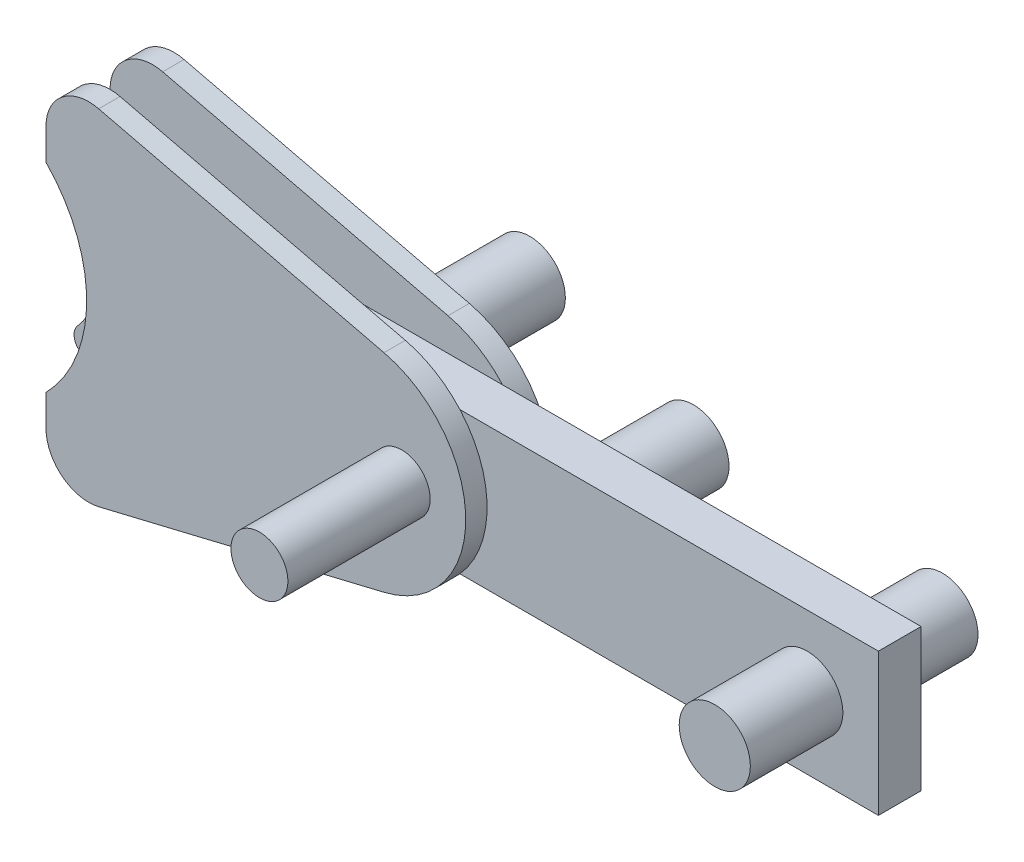
from build123d import *

# Parameters (mm, degrees)
BOSS_EXTRUDE2_DEPTH      = 1.5
SKETCH2_R                = 2.5
BOSS_EXTRUDE3_DEPTH      = 1.5
FILLET2_R                = 1
SKETCH3_R                = 2
BOSS_EXTRUDE4_DEPTH      = 10
BOSS_EXTRUDE5_DEPTH      = 5
BOSS_EXTRUDE5_DEPTH_BACK = 11
SKETCH6_R                = 2.5
SKETCH7_R                = 2.5
BOSS_EXTRUDE6_DEPTH      = 11
SKETCH8_R                = 2.5
BOSS_EXTRUDE7_DEPTH      = 8


with BuildPart() as part:
    # Sketch1 → Boss-Extrude2 (new body)
    with BuildSketch(Plane.XY):
        with BuildLine():
            Line((-35, 5), (25, 5))
            Line((25, 5), (25, -5))
            Line((25, -5), (-35, -5))
            ThreePointArc((-35, -5), (-30, 0), (-35, 5))
        make_face()
    boss_extrude2 = extrude(amount=BOSS_EXTRUDE2_DEPTH)

    # Sketch2 → Boss-Extrude3 (add)
    with BuildSketch(Plane.XY.offset(1.5)):
        with Locations(Location((20, 0, 0), (0, 0, 180))):
            Circle(SKETCH2_R)
        with BuildLine():
            Line((-32, -9.19371522), (-32, -7))
            ThreePointArc((-32, -7), (-29.141428429, 0), (-32, 7))
            Line((-32, 7), (-32, 9.19371522))
            ThreePointArc((-32, 9.19371522), (-30.857040195, 11.549856497), (-28.299065524, 12.110681257))
            Line((-28.299065524, 12.110681257), (-8.247663809, 7.292415092))
            ThreePointArc((-8.247663809, 7.292415092), (-2.5, 0), (-8.247663809, -7.292415092))
            Line((-8.247663809, -7.292415092), (-28.299065524, -12.110681257))
            ThreePointArc((-28.299065524, -12.110681257), (-30.857040195, -11.549856497), (-32, -9.19371522))
        make_face()
    boss_extrude3 = extrude(amount=BOSS_EXTRUDE3_DEPTH)

    # Mirror1: Boss-Extrude2, Boss-Extrude3 across plane
    add(boss_extrude2.mirror(Plane(origin=(-35, 0, 0), x_dir=(1, 0, 0), z_dir=(0, 0, -1))))
    add(boss_extrude3.mirror(Plane(origin=(-35, 0, 0), x_dir=(1, 0, 0), z_dir=(0, 0, -1))))

    # Fillet2
    fillet2_edges = [part.edges().sort_by_distance(p)[0] for p in [
        (-35, -5, 0),
        (-35, 5, 0),
    ]]
    fillet(fillet2_edges, radius=FILLET2_R)

    # Sketch3 → Boss-Extrude4 (add)
    with BuildSketch(Plane.XY.offset(3)):
        with Locations(Location((-7, 0, 0), (0, 0, 180))):
            Circle(SKETCH3_R)
    extrude(amount=BOSS_EXTRUDE4_DEPTH)

    # Sketch6 → Boss-Extrude5 (add, two sides: drawn at the far end of the back side and taken through both)
    with BuildSketch(Plane.XY.offset(3).offset(-BOSS_EXTRUDE5_DEPTH_BACK)):
        with Locations(Location((20, 0, 0), (0, 0, 180))):
            Circle(SKETCH6_R)
    extrude(amount=BOSS_EXTRUDE5_DEPTH + BOSS_EXTRUDE5_DEPTH_BACK)

    # Sketch7 → Boss-Extrude6 (add)
    with BuildSketch(Plane(origin=(0, 0, -3), x_dir=(-1, 0, 0), z_dir=(0, 0, -1))):
        with Locations(Location((15, 0, 0), (0, 0, 180))):
            Circle(SKETCH7_R)
    extrude(amount=BOSS_EXTRUDE6_DEPTH)

    # Sketch8 → Boss-Extrude7 (add)
    with BuildSketch(Plane(origin=(0, 0, -1.5), x_dir=(-1, 0, 0), z_dir=(0, 0, -1))):
        with Locations(Location((-1, 0, 0), (0, 0, 180))):
            Circle(SKETCH8_R)
    extrude(amount=BOSS_EXTRUDE7_DEPTH)


solid = part.part
